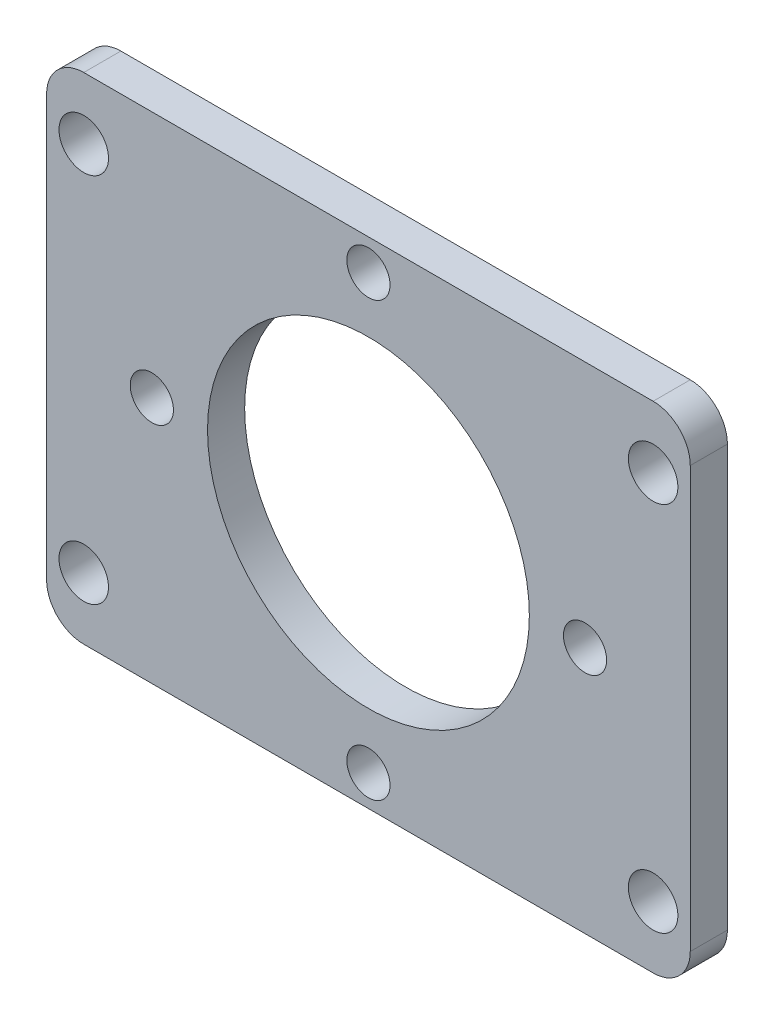
from build123d import *

# Parameters (mm, degrees)
SKETCH_1_W      = 52
SKETCH_1_H      = 40
SKETCH_1_R      = 13
SKETCH_1_R_2    = 1.744116192
SKETCH_1_R_3    = 2
EXTRUDE_1_DEPTH = 3
FILLET_1_R      = 3


with BuildPart() as part:
    # 草图1 → 凸台-拉伸1 (new body)
    with BuildSketch(Plane.XY):
        Rectangle(SKETCH_1_W, SKETCH_1_H)
        Circle(SKETCH_1_R, mode=Mode.SUBTRACT)
        with Locations((0, 17.5)):
            Circle(SKETCH_1_R_2, mode=Mode.SUBTRACT)
        with Locations((17.5, 0)):
            Circle(SKETCH_1_R_2, mode=Mode.SUBTRACT)
        with Locations((0, -17.5)):
            Circle(SKETCH_1_R_2, mode=Mode.SUBTRACT)
        with Locations((-17.5, 0)):
            Circle(SKETCH_1_R_2, mode=Mode.SUBTRACT)
        with Locations((-23, 15)):
            Circle(SKETCH_1_R_3, mode=Mode.SUBTRACT)
        with Locations(Location((23, 15, 0), (0, 0, 180))):
            Circle(SKETCH_1_R_3, mode=Mode.SUBTRACT)
        with Locations((23, -15)):
            Circle(SKETCH_1_R_3, mode=Mode.SUBTRACT)
        with Locations(Location((-23, -15, 0), (0, 0, 180))):
            Circle(SKETCH_1_R_3, mode=Mode.SUBTRACT)
    extrude(amount=EXTRUDE_1_DEPTH)

    # 圆角1
    fillet_1_edges = [part.edges().sort_by_distance(p)[0] for p in [
        (-26, 20, 1.5),
        (26, 20, 1.5),
        (26, -20, 1.5),
        (-26, -20, 1.5),
    ]]
    fillet(fillet_1_edges, radius=FILLET_1_R)


solid = part.part
